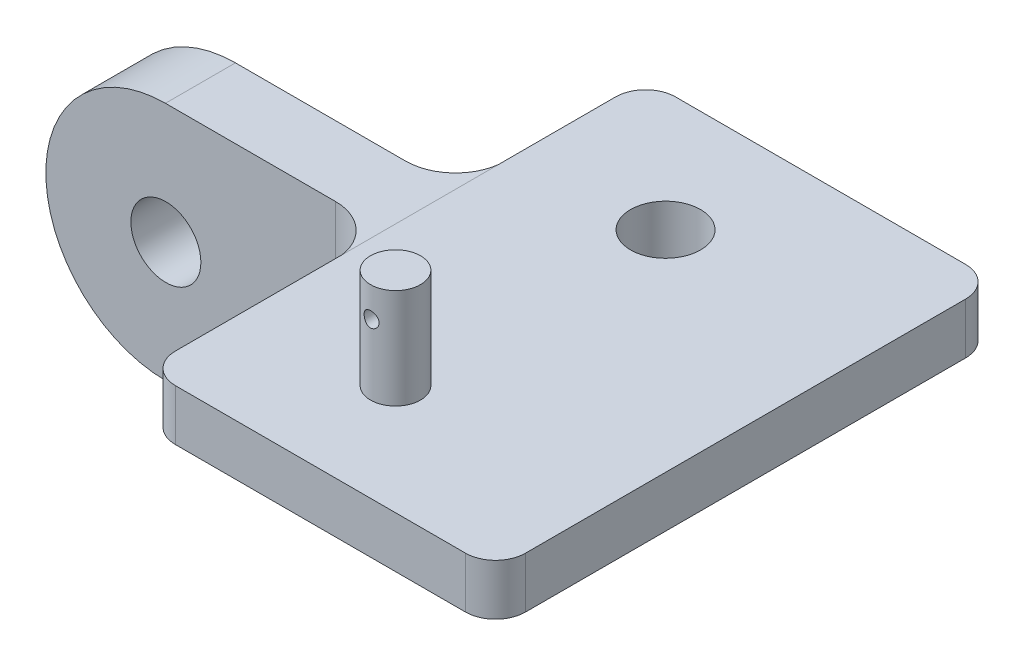
from build123d import *

# Parameters (mm, degrees)
SKETCH1_R           = 3.5
BOSS_EXTRUDE1_DEPTH = 7
SKETCH3_W           = 45
SKETCH3_H           = 5.102229266
BOSS_EXTRUDE3_DEPTH = 35
FILLET2_R           = 5
FILLET6_R           = 5
SKETCH4_R           = 3.5
CUT_EXTRUDE1_DEPTH  = 5.102229266
SKETCH5_R           = 2.5
BOSS_EXTRUDE4_DEPTH = 10
SKETCH6_W           = 35
SKETCH6_H           = 5.102229266
BOSS_EXTRUDE5_DEPTH = 5
FILLET14_R          = 3
FILLET15_R          = 3
SKETCH7_R           = 0.75
CUT_EXTRUDE2_DEPTH  = 20


with BuildPart() as part:
    # Sketch1 → Boss-Extrude1 (new body)
    with BuildSketch(Plane.XY):
        with BuildLine():
            Line((-0.043255317, 12), (21.956744683, 12))
            Line((21.956744683, 12), (21.956744683, 7))
            ThreePointArc((21.956744683, 7), (13.877753218, -5.850552891), (-1.128e-06, -11.999922533))
            ThreePointArc((-1.128e-06, -11.999922533), (-12.000117541, -0.021549663), (-0.043255317, 12))
        make_face()
        with Locations((-0.000137029, 7.7466e-05)):
            Circle(SKETCH1_R, mode=Mode.SUBTRACT)
    extrude(amount=BOSS_EXTRUDE1_DEPTH)

    # Sketch3 → Boss-Extrude3 (add)
    with BuildSketch(Plane(origin=(21.956744683, 0, 0), x_dir=(0, 0, -1), z_dir=(1, 0, 0))):
        with Locations((-3.5, 9.5)):
            Rectangle(SKETCH3_W, SKETCH3_H)
    extrude(amount=BOSS_EXTRUDE3_DEPTH)

    # Fillet2
    fillet2_edges = [part.edges().sort_by_distance(p)[0] for p in [
        (21.956744683, 9.5, 0),
    ]]
    fillet(fillet2_edges, radius=FILLET2_R)

    # Fillet6
    fillet6_edges = [part.edges().sort_by_distance(p)[0] for p in [
        (21.956744683, 9.5, 7),
    ]]
    fillet(fillet6_edges, radius=FILLET6_R)

    # Sketch4 → Cut-Extrude1 (cut)
    with BuildSketch(Plane(origin=(0, 12.051114633, 0), x_dir=(1, 0, 0), z_dir=(0, 1, 0))):
        with Locations(Location((35.956744683, 7, 0), (0, 0, 180))):
            Circle(SKETCH4_R)
    extrude(amount=-CUT_EXTRUDE1_DEPTH, mode=Mode.SUBTRACT)

    # Sketch5 → Boss-Extrude4 (add)
    with BuildSketch(Plane(origin=(0, 12.051114633, 0), x_dir=(1, 0, 0), z_dir=(0, 1, 0))):
        with Locations((35.956744683, -20)):
            Circle(SKETCH5_R)
    extrude(amount=BOSS_EXTRUDE4_DEPTH)

    # Sketch6 → Boss-Extrude5 (add)
    with BuildSketch(Plane.XY.offset(26)):
        with Locations((39.456744683, 9.5)):
            Rectangle(SKETCH6_W, SKETCH6_H)
    extrude(amount=BOSS_EXTRUDE5_DEPTH)

    # Fillet14
    fillet14_edges = [part.edges().sort_by_distance(p)[0] for p in [
        (56.956744683, 9.5, -19),
    ]]
    fillet(fillet14_edges, radius=FILLET14_R)

    # Fillet15
    fillet15_edges = [part.edges().sort_by_distance(p)[0] for p in [
        (21.956744683, 9.5, -19),
        (21.956744683, 9.5, 31),
        (56.956744683, 9.5, 31),
    ]]
    fillet(fillet15_edges, radius=FILLET15_R)

    # Sketch7 → Cut-Extrude2 (cut)
    with BuildSketch(Plane.XY.offset(31)):
        with Locations((35.956744683, 19.051114633)):
            Circle(SKETCH7_R)
    extrude(amount=-CUT_EXTRUDE2_DEPTH, mode=Mode.SUBTRACT)


solid = part.part
